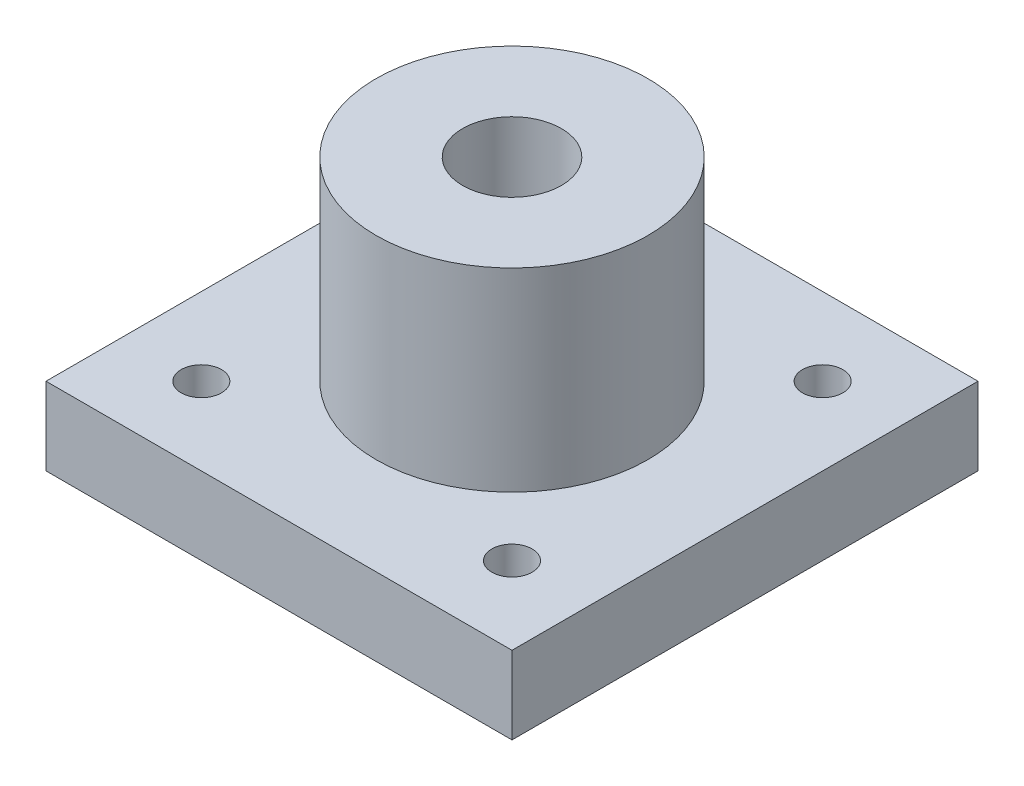
from build123d import *

# Parameters (mm, degrees)
SKETCH1_W           = 60
SKETCH1_H           = 60
SKETCH1_R           = 2.6
BOSS_EXTRUDE1_DEPTH = 10
SKETCH2_R           = 17.5
SKETCH2_R_2         = 6.35889
BOSS_EXTRUDE2_DEPTH = 25


with BuildPart() as part:
    # Sketch1 → Boss-Extrude1 (new body)
    with BuildSketch(Plane(origin=(0, 0, 0), x_dir=(1, 0, 0), z_dir=(0, 1, 0))):
        Rectangle(SKETCH1_W, SKETCH1_H)
        with Locations(Location((-20, 20, 0), (0, 0, 270))):
            Circle(SKETCH1_R, mode=Mode.SUBTRACT)
        with Locations(Location((20, 20, 0), (0, 0, 270))):
            Circle(SKETCH1_R, mode=Mode.SUBTRACT)
        with Locations(Location((-20, -20, 0), (0, 0, 270))):
            Circle(SKETCH1_R, mode=Mode.SUBTRACT)
        with Locations(Location((20, -20, 0), (0, 0, 270))):
            Circle(SKETCH1_R, mode=Mode.SUBTRACT)
    extrude(amount=BOSS_EXTRUDE1_DEPTH)

    # Sketch2 → Boss-Extrude2 (add)
    with BuildSketch(Plane(origin=(0, 10, 0), x_dir=(1, 0, 0), z_dir=(0, 1, 0))):
        with Locations(Location((0, 0, 0), (0, 0, 270))):
            Circle(SKETCH2_R)
        with Locations(Location((0, 0, 0), (0, 0, 270))):
            Circle(SKETCH2_R_2, mode=Mode.SUBTRACT)
    extrude(amount=BOSS_EXTRUDE2_DEPTH)


solid = part.part
